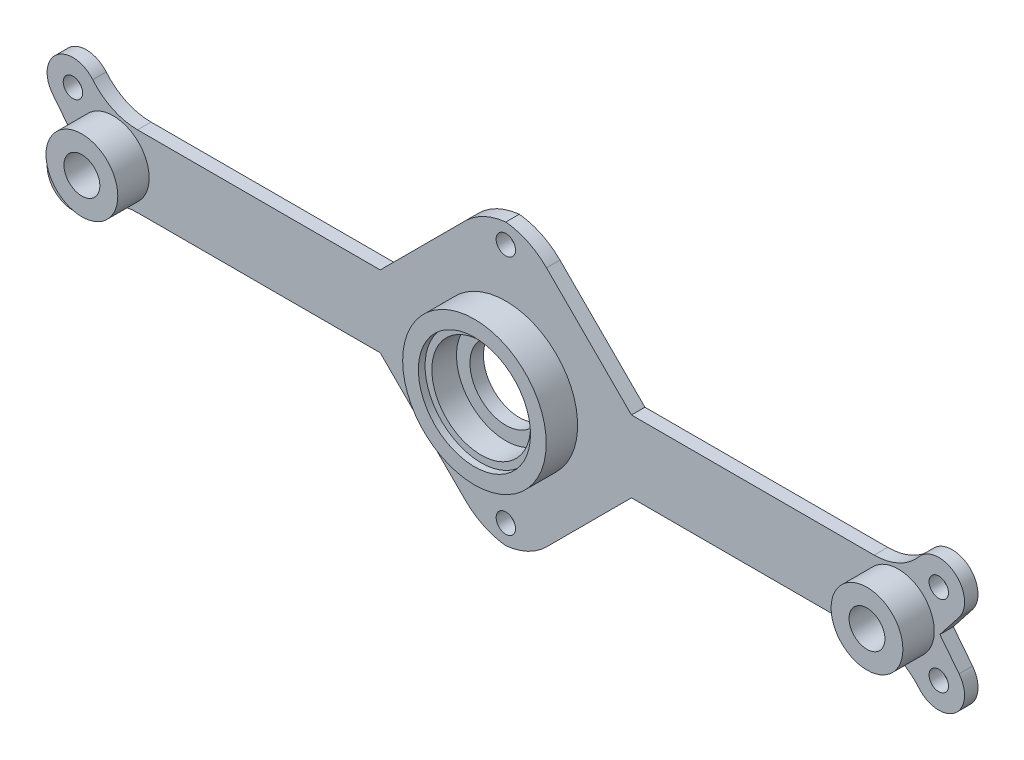
from build123d import *

# Parameters (mm, degrees)
SKETCH1_W               = 204.5
SKETCH1_H               = 62.5
BOSS_EXTRUDE1_DEPTH     = 3
SKETCH2_R               = 8
BOSS_EXTRUDE2_DEPTH     = 7
SKETCH3_R               = 16
BOSS_EXTRUDE3_DEPTH     = 7
SKETCH4_R               = 2.165
CUT_EXTRUDE1_DEPTH      = 108.147678463
SKETCH5_R               = 2.165
CUT_EXTRUDE2_DEPTH      = 108.147678463
CUT_EXTRUDE3_DEPTH      = 7
MIRROR2_COPY_1_SKETCH_R = 2.165
MIRROR2_COPY_1_DEPTH    = 108.147678463
MIRROR2_COPY_2_DEPTH    = 7
MIRROR2_COPY_3_SKETCH_R = 2.165
MIRROR2_COPY_3_DEPTH    = 108.147678463
SKETCH7_R               = 12.5
CUT_EXTRUDE4_DEPTH      = 1.5
SKETCH9_R               = 11
CUT_EXTRUDE5_DEPTH      = 7
SKETCH10_R              = 8
CUT_EXTRUDE6_DEPTH      = 108.147678463
SKETCH11_R              = 4
CUT_EXTRUDE7_DEPTH      = 7


with BuildPart() as part:
    # Sketch1 → Boss-Extrude1 (new body)
    with BuildSketch(Plane.XY):
        Rectangle(SKETCH1_W, SKETCH1_H)
    extrude(amount=BOSS_EXTRUDE1_DEPTH)

    # Sketch2 → Boss-Extrude2 (add)
    with BuildSketch(Plane.XY.offset(3)):
        with Locations(Location((-87.5, 0, 0), (0, 0, 180))):
            Circle(SKETCH2_R)
        with Locations(Location((87.5, 0, 0), (0, 0, 180))):
            Circle(SKETCH2_R)
    extrude(amount=BOSS_EXTRUDE2_DEPTH)

    # Sketch3 → Boss-Extrude3 (add)
    with BuildSketch(Plane.XY.offset(3)):
        with Locations(Location((0, 0, 0), (0, 0, 180))):
            Circle(SKETCH3_R)
    extrude(amount=BOSS_EXTRUDE3_DEPTH)

    # Sketch4 → Cut-Extrude1 (cut, through all)
    with BuildSketch(Plane.XY.offset(3)):
        with Locations((-96.5, 9)):
            Circle(SKETCH4_R)
        with Locations((-96.5, -9)):
            Circle(SKETCH4_R)
    cut_extrude1 = extrude(amount=-CUT_EXTRUDE1_DEPTH, mode=Mode.SUBTRACT)

    # Sketch5 → Cut-Extrude2 (cut, through all)
    with BuildSketch(Plane.XY.offset(3)):
        with Locations((0, 26.875)):
            Circle(SKETCH5_R)
        with Locations((0, -26.875)):
            Circle(SKETCH5_R)
    extrude(amount=-CUT_EXTRUDE2_DEPTH, mode=Mode.SUBTRACT)

    # Sketch6 → Cut-Extrude3 (cut)
    with BuildSketch(Plane.XY.offset(3)):
        with BuildLine():
            Line((-102.25, 0), (-102.25, -9))
            ThreePointArc((-102.25, -9), (-101.935103767, -7.123261595), (-101.024905378, -5.452080705))
            Line((-101.024905378, -5.452080705), (-96.75, 0))
            Line((-96.75, 0), (-102.25, 0))
        make_face()
        with BuildLine():
            Line((-28, -8), (-82.092970466, -8))
            ThreePointArc((-82.092970466, -8), (-87.608403359, -9.22799932), (-92.081844276, -12.68))
            ThreePointArc((-92.081844276, -12.68), (-98.456796437, -14.406796437), (-102.25, -9))
            Line((-102.25, -9), (-102.25, -31.25))
            Line((-102.25, -31.25), (0, -31.25))
            ThreePointArc((0, -31.25), (-4.903490235, -29.873770102), (-9.063851408, -26.936148592))
            Line((-9.063851408, -26.936148592), (-28, -8))
        make_face()
    cut_extrude3 = extrude(amount=-CUT_EXTRUDE3_DEPTH, mode=Mode.SUBTRACT)

    # Mirror1: Cut-Extrude1, Cut-Extrude3 across plane
    add(cut_extrude1.mirror(Plane(origin=(0, 0, 0), x_dir=(0, 0, 1), z_dir=(1, 0, 0))), mode=Mode.SUBTRACT)
    add(cut_extrude3.mirror(Plane(origin=(0, 0, 0), x_dir=(0, 0, 1), z_dir=(1, 0, 0))), mode=Mode.SUBTRACT)

    # Mirror2: Cut-Extrude3 across plane
    add(cut_extrude3.mirror(Plane.ZX), mode=Mode.SUBTRACT)

    # Mirror2 copy 1 sketch → Mirror2 copy 1 (cut, through all)
    with BuildSketch(Plane(origin=(0, 0, 3), x_dir=(-1, 0, 0), z_dir=(0, 0, 1))):
        with Locations((-96.5, 9)):
            Circle(MIRROR2_COPY_1_SKETCH_R)
        with Locations((-96.5, -9)):
            Circle(MIRROR2_COPY_1_SKETCH_R)
    extrude(amount=-MIRROR2_COPY_1_DEPTH, mode=Mode.SUBTRACT)

    # Mirror2 copy 2 sketch → Mirror2 copy 2 (cut)
    with BuildSketch(Plane(origin=(0, 0, 3), x_dir=(-1, 0, 0), z_dir=(0, 0, 1))):
        with BuildLine():
            Line((-102.25, 0), (-102.25, -9))
            ThreePointArc((-102.25, -9), (-101.935103767, -7.123261595), (-101.024905378, -5.452080705))
            Line((-101.024905378, -5.452080705), (-96.75, 0))
            Line((-96.75, 0), (-102.25, 0))
        make_face()
        with BuildLine():
            Line((-28, -8), (-82.092970466, -8))
            ThreePointArc((-82.092970466, -8), (-87.608403359, -9.22799932), (-92.081844276, -12.68))
            ThreePointArc((-92.081844276, -12.68), (-98.456796437, -14.406796437), (-102.25, -9))
            Line((-102.25, -9), (-102.25, -31.25))
            Line((-102.25, -31.25), (0, -31.25))
            ThreePointArc((0, -31.25), (-4.903490235, -29.873770102), (-9.063851408, -26.936148592))
            Line((-9.063851408, -26.936148592), (-28, -8))
        make_face()
    extrude(amount=-MIRROR2_COPY_2_DEPTH, mode=Mode.SUBTRACT)

    # Mirror2 copy 3 sketch → Mirror2 copy 3 (cut, through all)
    with BuildSketch(Plane.XY.offset(3)):
        with Locations((-96.5, -9)):
            Circle(MIRROR2_COPY_3_SKETCH_R)
        with Locations((-96.5, 9)):
            Circle(MIRROR2_COPY_3_SKETCH_R)
    extrude(amount=-MIRROR2_COPY_3_DEPTH, mode=Mode.SUBTRACT)

    # Sketch7 → Cut-Extrude4 (cut)
    with BuildSketch(Plane.XY.offset(10)):
        Circle(SKETCH7_R)
    extrude(amount=-CUT_EXTRUDE4_DEPTH, mode=Mode.SUBTRACT)

    # Sketch9 → Cut-Extrude5 (cut)
    with BuildSketch(Plane.XY.offset(10)):
        Circle(SKETCH9_R)
    extrude(amount=-CUT_EXTRUDE5_DEPTH, mode=Mode.SUBTRACT)

    # Sketch10 → Cut-Extrude6 (cut, through all)
    with BuildSketch(Plane.XY.offset(3)):
        Circle(SKETCH10_R)
    extrude(amount=-CUT_EXTRUDE6_DEPTH, mode=Mode.SUBTRACT)

    # Sketch11 → Cut-Extrude7 (cut)
    with BuildSketch(Plane.XY.offset(10)):
        with Locations((-87.5, 0)):
            Circle(SKETCH11_R)
        with Locations((87.5, 0)):
            Circle(SKETCH11_R)
    extrude(amount=-CUT_EXTRUDE7_DEPTH, mode=Mode.SUBTRACT)


solid = part.part
